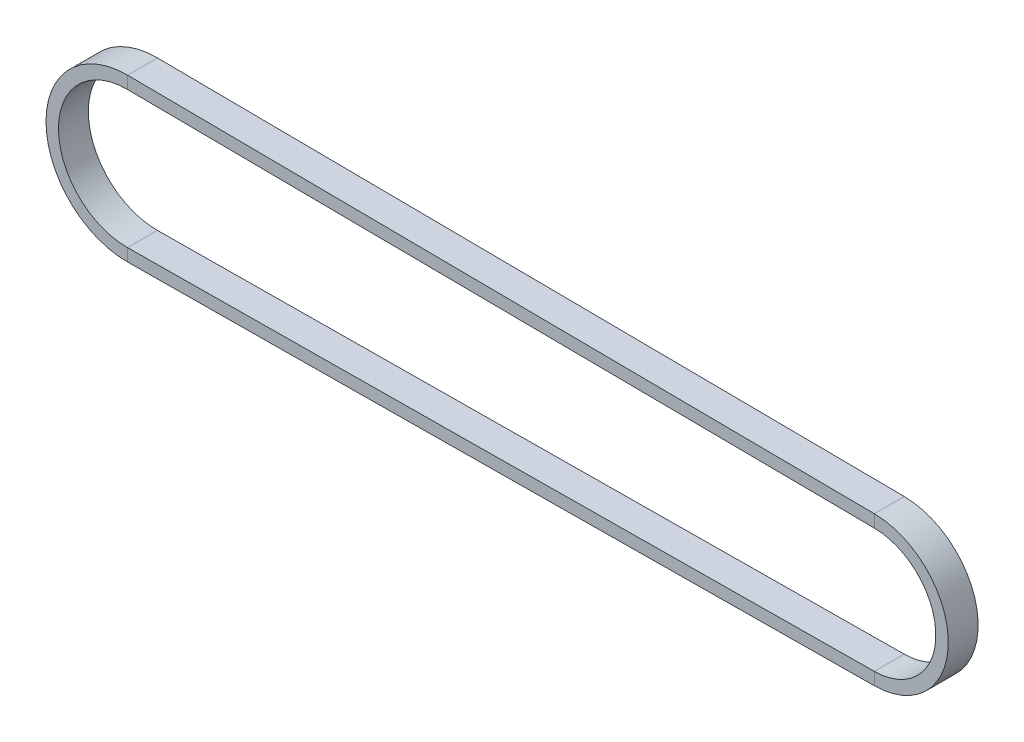
from build123d import *

# Parameters (mm, degrees)
SK_CHAIN_PROFILE_W = 12
SK_CHAIN_PROFILE_H = 5


with BuildPart() as part:
    # FT_Chain_Envelope: sweep along a path in SK_Chain_Path
    with BuildLine(Plane.XY) as ft_chain_envelope_path:
        Line((0.235356499, -27.424490106), (-299.74255, -29.998895305))
        ThreePointArc((-299.74255, -29.998895305), (-330, 0), (-299.74255, 29.998895305))
        Line((-299.74255, 29.998895305), (0.235356499, 27.424490106))
        ThreePointArc((0.235356499, 27.424490106), (27.4255, 0), (0.235356499, -27.424490106))
    # SK_Chain_Profile → FT_Chain_Envelope (sweep)
    with BuildSketch(Plane(origin=(-299.74255, 29.998895305, 0), x_dir=(0, 0, -1), z_dir=(0.9999631768206378, -0.008581666666666639, 0))):
        Rectangle(SK_CHAIN_PROFILE_W, SK_CHAIN_PROFILE_H)
    sweep(path=ft_chain_envelope_path.line)


solid = part.part
